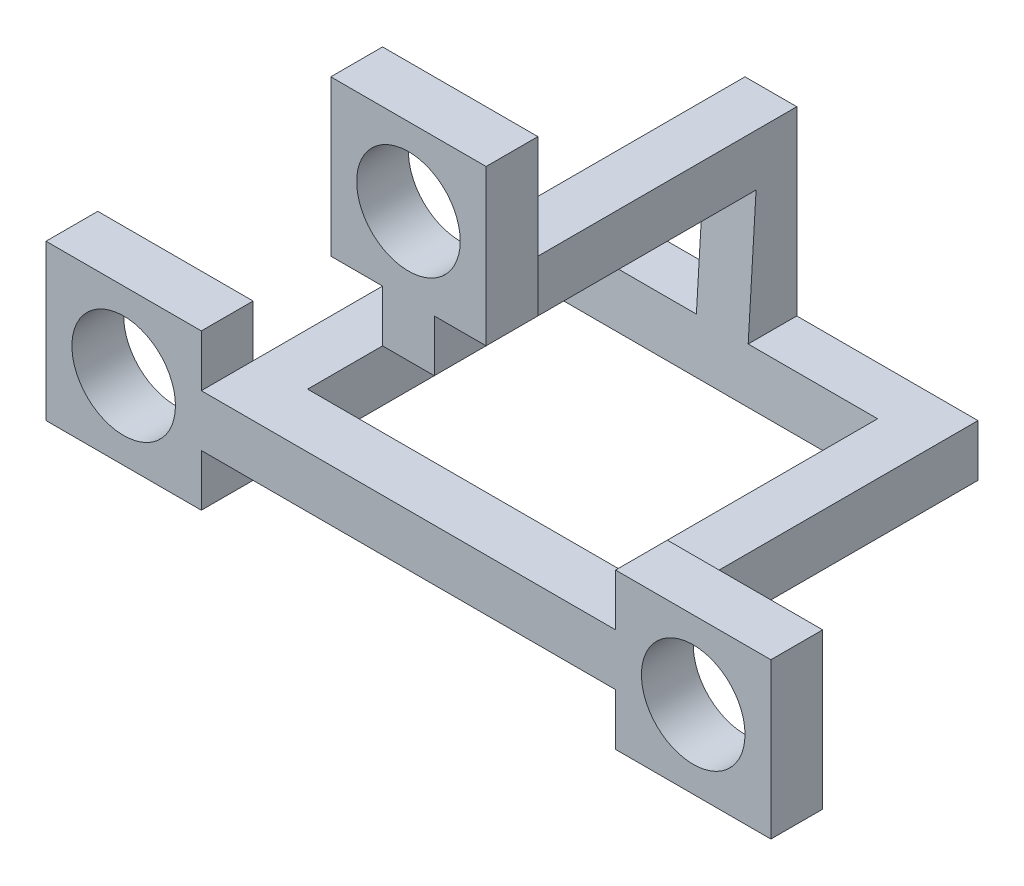
from build123d import *

# Parameters (mm, degrees)
SKETCH6_W           = 12
SKETCH6_H           = 8
BOSS_EXTRUDE5_DEPTH = 1
SKETCH7_W           = 6
SKETCH7_H           = 2
BOSS_EXTRUDE6_DEPTH = 2
SKETCH8_W           = 12
SKETCH8_H           = 10
CUT_EXTRUDE4_DEPTH  = 2.5
BOSS_EXTRUDE7_DEPTH = 1
SKETCH12_W          = 6
SKETCH12_H          = 6
BOSS_EXTRUDE9_DEPTH = 2
SKETCH13_R          = 2
CUT_EXTRUDE7_DEPTH  = 25.248711306


with BuildPart() as part:
    # Sketch6 → Boss-Extrude5 (new, symmetric)
    with BuildSketch(Plane(origin=(0, 0, 0), x_dir=(1, 0, 0), z_dir=(0, 1, 0))):
        Polygon((-14, 0), (14, 0), (14, 2), (8, 2), (8, 14), (-8, 14), (-8, 2), (-14, 2), align=None)
        with Locations((0, 8)):
            Rectangle(SKETCH6_W, SKETCH6_H, mode=Mode.SUBTRACT)
    extrude(amount=BOSS_EXTRUDE5_DEPTH, both=True)

    # Sketch7 → Boss-Extrude6 (add)
    with BuildSketch(Plane(origin=(0, 0, -2), x_dir=(-1, 0, 0), z_dir=(0, 0, -1))):
        with Locations((11, 2)):
            Rectangle(SKETCH7_W, SKETCH7_H)
        with Locations((11, -2)):
            Rectangle(SKETCH7_W, SKETCH7_H)
    boss_extrude6 = extrude(amount=-BOSS_EXTRUDE6_DEPTH)

    # Mirror2: Boss-Extrude6 across plane
    add(boss_extrude6.mirror(Plane(origin=(0, 0, 0), x_dir=(0, 0, 1), z_dir=(1, 0, 0))))

    # Sketch8 → Cut-Extrude4 (cut, symmetric)
    with BuildSketch(Plane(origin=(0, -0.265057015, 0.016211582), x_dir=(-1, 0, 0), z_dir=(0, 0.9981347984218666, -0.061048539534864034))):
        with Locations((0, -7.038666121)):
            Rectangle(SKETCH8_W, SKETCH8_H)
    extrude(amount=CUT_EXTRUDE4_DEPTH, both=True, mode=Mode.SUBTRACT)

    # Sketch10 → Boss-Extrude7 (add, symmetric)
    with BuildSketch(Plane(origin=(0, 0, 0), x_dir=(0, 0, -1), z_dir=(1, 0, 0))):
        Polygon((12.12232524, 1), (12.428138341, 6), (0, 6), (0, 14), (2, 14), (2, 8), (14, 8), (14, 1), align=None)
    extrude(amount=BOSS_EXTRUDE7_DEPTH, both=True)

    # Sketch12 → Boss-Extrude9 (add)
    with BuildSketch(Plane(origin=(0, 0, -2), x_dir=(-1, 0, 0), z_dir=(0, 0, -1))):
        with Locations((0, 11)):
            Rectangle(SKETCH12_W, SKETCH12_H)
    extrude(amount=-BOSS_EXTRUDE9_DEPTH)

    # Sketch13 → Cut-Extrude7 (cut, through all)
    with BuildSketch(Plane.XY):
        with Locations((-11, 0)):
            Circle(SKETCH13_R)
        with Locations((11, 0)):
            Circle(SKETCH13_R)
        with Locations((0, 11)):
            Circle(SKETCH13_R)
    extrude(amount=-CUT_EXTRUDE7_DEPTH, mode=Mode.SUBTRACT)


solid = part.part
